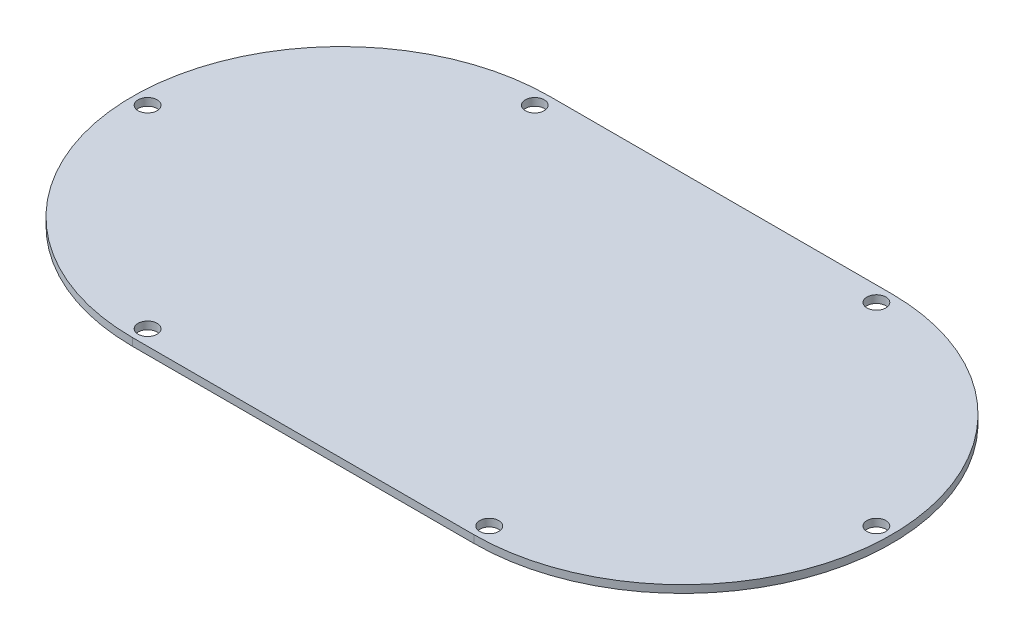
from build123d import *

# Parameters (mm, degrees)
SKETCH_1_R      = 2.5
EXTRUDE_1_DEPTH = 2


with BuildPart() as part:
    # 草图1 → 凸台-拉伸1 (new body)
    with BuildSketch(Plane(origin=(0, 0, 0), x_dir=(1, 0, 0), z_dir=(0, 1, 0))):
        with BuildLine():
            Line((-45, 55), (45, 55))
            ThreePointArc((45, 55), (100, 0), (45, -55))
            Line((45, -55), (-45, -55))
            ThreePointArc((-45, -55), (-100, 0), (-45, 55))
        make_face()
        with Locations(Location((-96, 0, 0), (0, 0, 270))):
            Circle(SKETCH_1_R, mode=Mode.SUBTRACT)
        with Locations(Location((-45, 51, 0), (0, 0, 270))):
            Circle(SKETCH_1_R, mode=Mode.SUBTRACT)
        with Locations(Location((45, 51, 0), (0, 0, 90))):
            Circle(SKETCH_1_R, mode=Mode.SUBTRACT)
        with Locations(Location((96, 0, 0), (0, 0, 90))):
            Circle(SKETCH_1_R, mode=Mode.SUBTRACT)
        with Locations(Location((45, -51, 0), (0, 0, 270))):
            Circle(SKETCH_1_R, mode=Mode.SUBTRACT)
        with Locations(Location((-45, -51, 0), (0, 0, 90))):
            Circle(SKETCH_1_R, mode=Mode.SUBTRACT)
    extrude(amount=EXTRUDE_1_DEPTH)


solid = part.part
